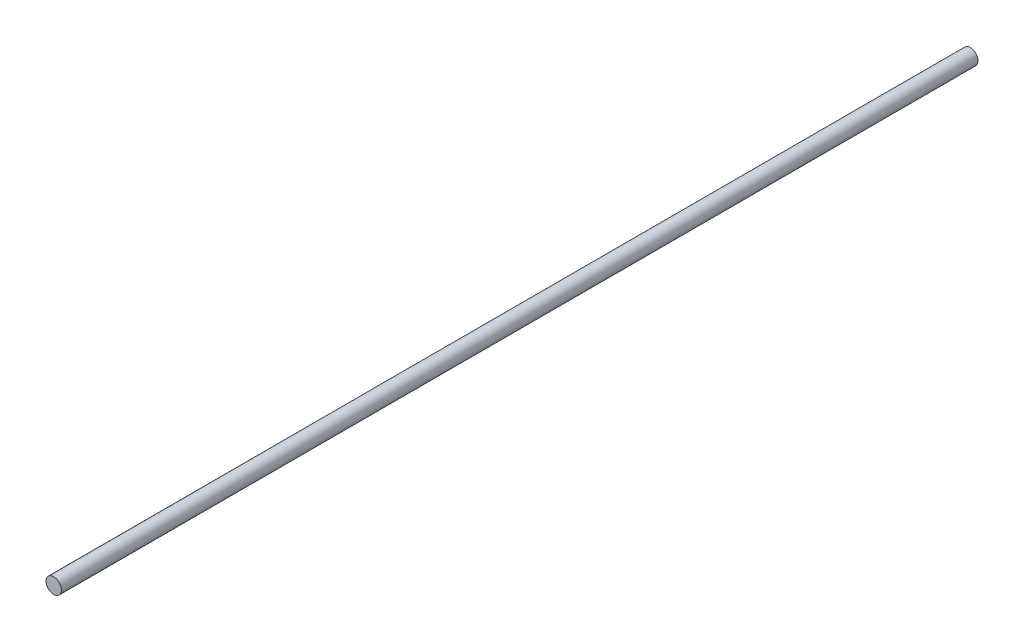
from build123d import *

# Parameters (mm, degrees)
SKETCH1_R           = 0.8001
BOSS_EXTRUDE1_DEPTH = 95.25


with BuildPart() as part:
    # Sketch1 → Boss-Extrude1 (new body)
    with BuildSketch(Plane.XY):
        Circle(SKETCH1_R)
    extrude(amount=BOSS_EXTRUDE1_DEPTH)


solid = part.part
